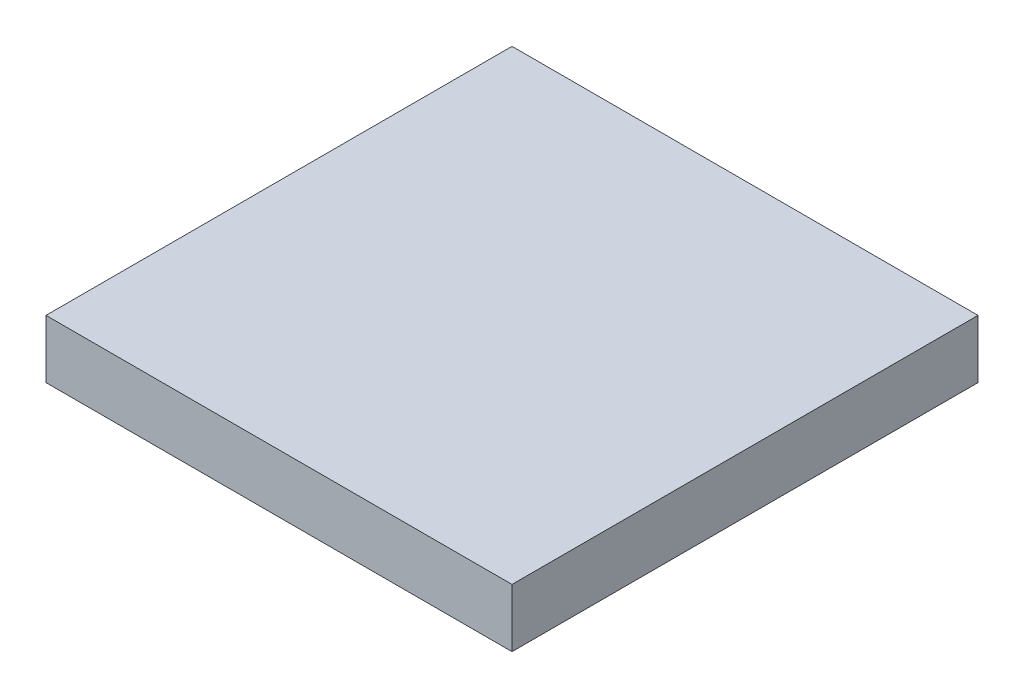
from build123d import *

# Parameters (mm, degrees)
SKETCH1_W           = 20
SKETCH1_H           = 20
BOSS_EXTRUDE1_DEPTH = 2.5


with BuildPart() as part:
    # Sketch1 → Boss-Extrude1 (new body)
    with BuildSketch(Plane(origin=(0, 0, 0), x_dir=(1, 0, 0), z_dir=(0, 1, 0))):
        with Locations((10, 10)):
            Rectangle(SKETCH1_W, SKETCH1_H)
    extrude(amount=BOSS_EXTRUDE1_DEPTH)


solid = part.part
